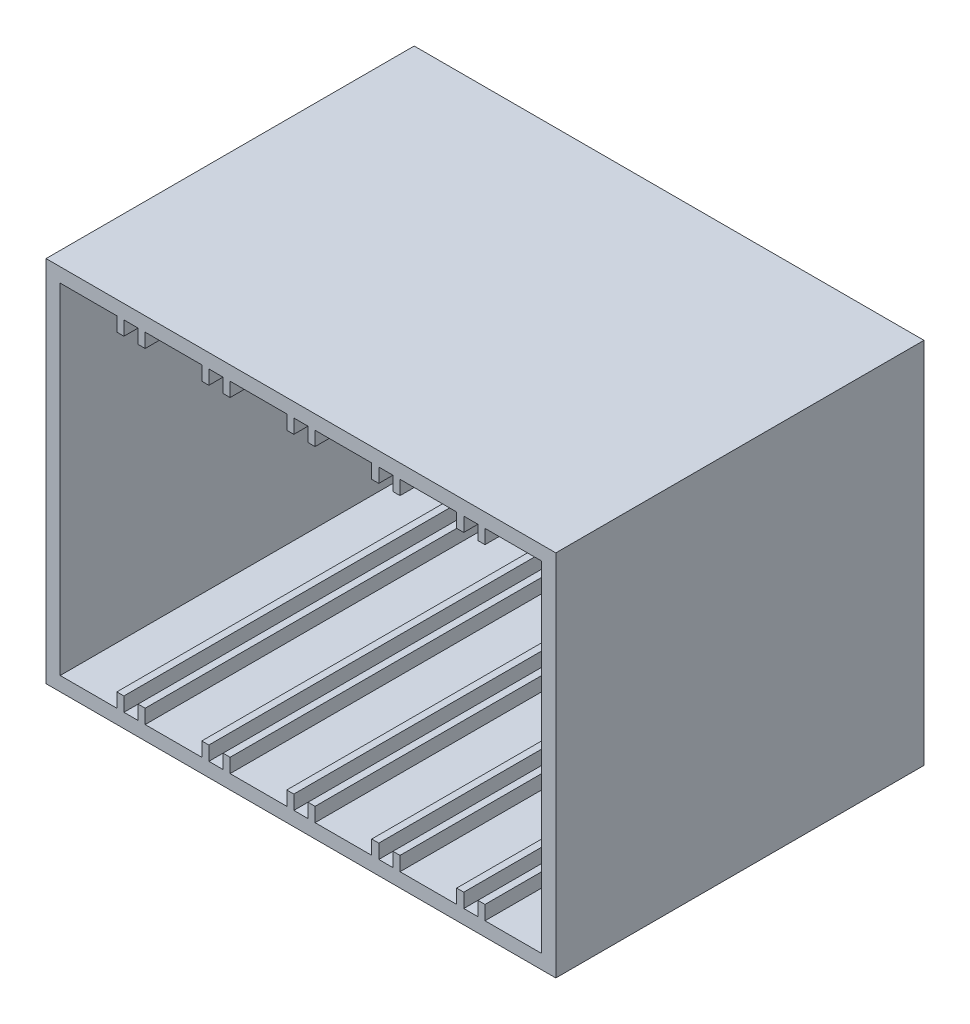
from build123d import *

# Parameters (mm, degrees)
SKETCH2_W           = 6.35
SKETCH2_H           = 152.4
SKETCH2_H_2         = 6.35
SKETCH2_W_2         = 25.4
SKETCH2_W_3         = 3.175
BOSS_EXTRUDE1_DEPTH = 152.4
SKETCH3_W           = 228.6
SKETCH3_H           = 165.1
BOSS_EXTRUDE2_DEPTH = 12.7


with BuildPart() as part:
    # Sketch2 → Boss-Extrude1 (new body)
    with BuildSketch(Plane.XY):
        with Locations((-111.125, 79.375)):
            Rectangle(SKETCH2_W, SKETCH2_H)
        with Locations((-111.125, 158.75)):
            Rectangle(SKETCH2_W, SKETCH2_H_2)
        with Locations((-95.25, 158.75)):
            Rectangle(SKETCH2_W_2, SKETCH2_H_2)
        with Locations((-80.9625, 158.75)):
            Rectangle(SKETCH2_W_3, SKETCH2_H_2)
        with Locations((-76.2, 158.75)):
            Rectangle(SKETCH2_W, SKETCH2_H_2)
        with Locations((-71.4375, 158.75)):
            Rectangle(SKETCH2_W_3, SKETCH2_H_2)
        with Locations((-57.15, 158.75)):
            Rectangle(SKETCH2_W_2, SKETCH2_H_2)
        with Locations((-42.8625, 158.75)):
            Rectangle(SKETCH2_W_3, SKETCH2_H_2)
        with Locations((-42.8625, 152.4)):
            Rectangle(SKETCH2_W_3, SKETCH2_H_2)
        with Locations((-38.1, 158.75)):
            Rectangle(SKETCH2_W, SKETCH2_H_2)
        with Locations((-33.3375, 158.75)):
            Rectangle(SKETCH2_W_3, SKETCH2_H_2)
        with Locations((-33.3375, 152.4)):
            Rectangle(SKETCH2_W_3, SKETCH2_H_2)
        with Locations((-19.05, 158.75)):
            Rectangle(SKETCH2_W_2, SKETCH2_H_2)
        with Locations((-4.7625, 158.75)):
            Rectangle(SKETCH2_W_3, SKETCH2_H_2)
        with Locations((-4.7625, 152.4)):
            Rectangle(SKETCH2_W_3, SKETCH2_H_2)
        with Locations((0, 158.75)):
            Rectangle(SKETCH2_W, SKETCH2_H_2)
        with Locations((4.7625, 158.75)):
            Rectangle(SKETCH2_W_3, SKETCH2_H_2)
        with Locations((4.7625, 152.4)):
            Rectangle(SKETCH2_W_3, SKETCH2_H_2)
        with Locations((19.05, 158.75)):
            Rectangle(SKETCH2_W_2, SKETCH2_H_2)
        with Locations((33.3375, 158.75)):
            Rectangle(SKETCH2_W_3, SKETCH2_H_2)
        with Locations((38.1, 158.75)):
            Rectangle(SKETCH2_W, SKETCH2_H_2)
        with Locations((33.3375, 152.4)):
            Rectangle(SKETCH2_W_3, SKETCH2_H_2)
        with Locations((42.8625, 152.4)):
            Rectangle(SKETCH2_W_3, SKETCH2_H_2)
        with Locations((42.8625, 158.75)):
            Rectangle(SKETCH2_W_3, SKETCH2_H_2)
        with Locations((57.15, 158.75)):
            Rectangle(SKETCH2_W_2, SKETCH2_H_2)
        with Locations((71.4375, 158.75)):
            Rectangle(SKETCH2_W_3, SKETCH2_H_2)
        with Locations((71.4375, 152.4)):
            Rectangle(SKETCH2_W_3, SKETCH2_H_2)
        with Locations((76.2, 158.75)):
            Rectangle(SKETCH2_W, SKETCH2_H_2)
        with Locations((80.9625, 158.75)):
            Rectangle(SKETCH2_W_3, SKETCH2_H_2)
        with Locations((80.9625, 152.4)):
            Rectangle(SKETCH2_W_3, SKETCH2_H_2)
        with Locations((95.25, 158.75)):
            Rectangle(SKETCH2_W_2, SKETCH2_H_2)
        with Locations((111.125, 158.75)):
            Rectangle(SKETCH2_W, SKETCH2_H_2)
        with Locations((111.125, 79.375)):
            Rectangle(SKETCH2_W, SKETCH2_H)
        with Locations((-111.125, 0)):
            Rectangle(SKETCH2_W, SKETCH2_H_2)
        with Locations((-95.25, 0)):
            Rectangle(SKETCH2_W_2, SKETCH2_H_2)
        with Locations((-80.9625, 0)):
            Rectangle(SKETCH2_W_3, SKETCH2_H_2)
        with Locations((-80.9625, 6.35)):
            Rectangle(SKETCH2_W_3, SKETCH2_H_2)
        with Locations((-76.2, 0)):
            Rectangle(SKETCH2_W, SKETCH2_H_2)
        with Locations((-71.4375, 0)):
            Rectangle(SKETCH2_W_3, SKETCH2_H_2)
        with Locations((-71.4375, 6.35)):
            Rectangle(SKETCH2_W_3, SKETCH2_H_2)
        with Locations((-57.15, 0)):
            Rectangle(SKETCH2_W_2, SKETCH2_H_2)
        with Locations((-42.8625, 0)):
            Rectangle(SKETCH2_W_3, SKETCH2_H_2)
        with Locations((-42.8625, 6.35)):
            Rectangle(SKETCH2_W_3, SKETCH2_H_2)
        with Locations((-38.1, 0)):
            Rectangle(SKETCH2_W, SKETCH2_H_2)
        with Locations((-33.3375, 0)):
            Rectangle(SKETCH2_W_3, SKETCH2_H_2)
        with Locations((-33.3375, 6.35)):
            Rectangle(SKETCH2_W_3, SKETCH2_H_2)
        with Locations((-19.05, 0)):
            Rectangle(SKETCH2_W_2, SKETCH2_H_2)
        with Locations((-4.7625, 0)):
            Rectangle(SKETCH2_W_3, SKETCH2_H_2)
        with Locations((-4.7625, 6.35)):
            Rectangle(SKETCH2_W_3, SKETCH2_H_2)
        Rectangle(SKETCH2_W, SKETCH2_H_2)
        with Locations((4.7625, 0)):
            Rectangle(SKETCH2_W_3, SKETCH2_H_2)
        with Locations((4.7625, 6.35)):
            Rectangle(SKETCH2_W_3, SKETCH2_H_2)
        with Locations((19.05, 0)):
            Rectangle(SKETCH2_W_2, SKETCH2_H_2)
        with Locations((111.125, 0)):
            Rectangle(SKETCH2_W, SKETCH2_H_2)
        with Locations((95.25, 0)):
            Rectangle(SKETCH2_W_2, SKETCH2_H_2)
        with Locations((80.9625, 0)):
            Rectangle(SKETCH2_W_3, SKETCH2_H_2)
        with Locations((80.9625, 6.35)):
            Rectangle(SKETCH2_W_3, SKETCH2_H_2)
        with Locations((71.4375, 6.35)):
            Rectangle(SKETCH2_W_3, SKETCH2_H_2)
        with Locations((76.2, 0)):
            Rectangle(SKETCH2_W, SKETCH2_H_2)
        with Locations((71.4375, 0)):
            Rectangle(SKETCH2_W_3, SKETCH2_H_2)
        with Locations((57.15, 0)):
            Rectangle(SKETCH2_W_2, SKETCH2_H_2)
        with Locations((42.8625, 6.35)):
            Rectangle(SKETCH2_W_3, SKETCH2_H_2)
        with Locations((33.3375, 6.35)):
            Rectangle(SKETCH2_W_3, SKETCH2_H_2)
        with Locations((33.3375, 0)):
            Rectangle(SKETCH2_W_3, SKETCH2_H_2)
        with Locations((38.1, 0)):
            Rectangle(SKETCH2_W, SKETCH2_H_2)
        with Locations((42.8625, 0)):
            Rectangle(SKETCH2_W_3, SKETCH2_H_2)
        with Locations((-80.9625, 152.4)):
            Rectangle(SKETCH2_W_3, SKETCH2_H_2)
        with Locations((-71.4375, 152.4)):
            Rectangle(SKETCH2_W_3, SKETCH2_H_2)
    extrude(amount=BOSS_EXTRUDE1_DEPTH)

    # Sketch3 → Boss-Extrude2 (add)
    with BuildSketch(Plane(origin=(0, 0, 0), x_dir=(-1, 0, 0), z_dir=(0, 0, -1))):
        with Locations((0, 79.375)):
            Rectangle(SKETCH3_W, SKETCH3_H)
    extrude(amount=BOSS_EXTRUDE2_DEPTH)


solid = part.part
